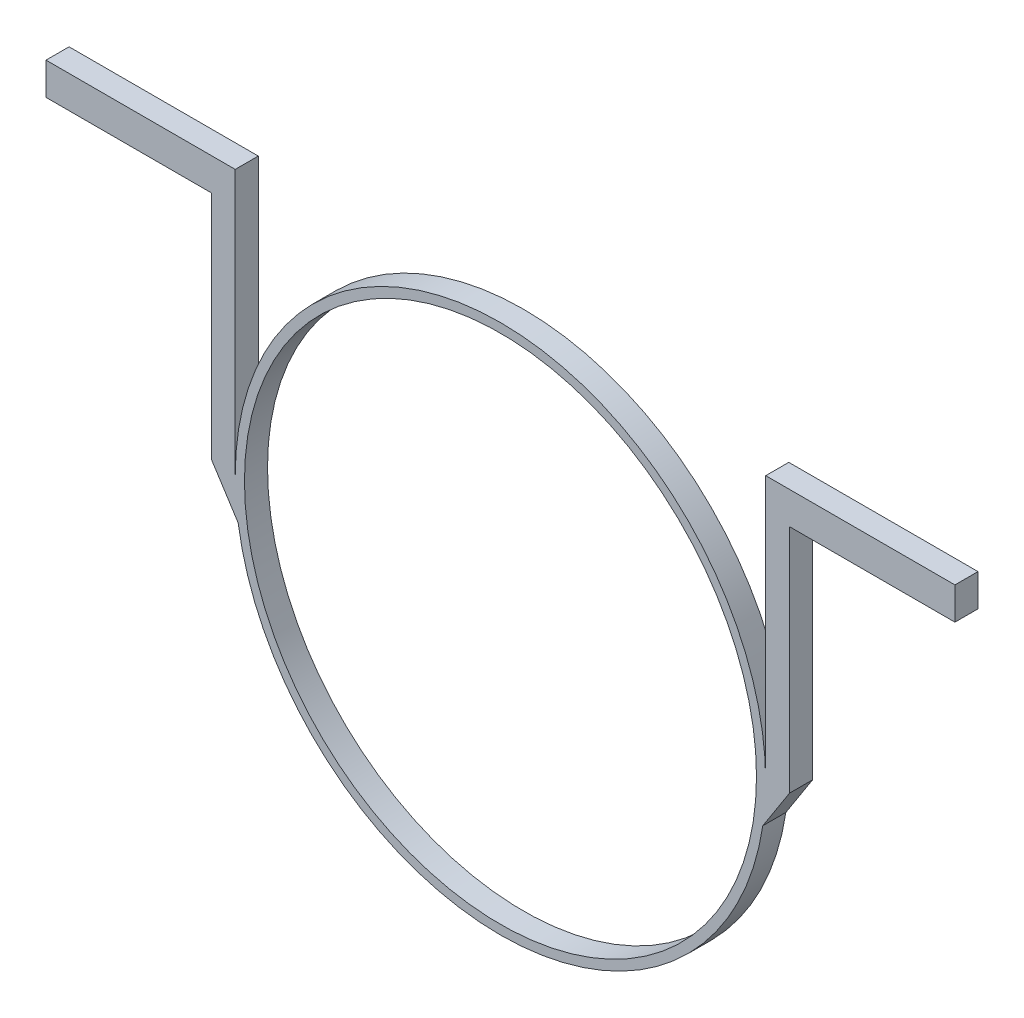
from build123d import *

# Parameters (mm, degrees)
SKETCH1_R           = 57.5
SKETCH1_R_2         = 55.5
BOSS_EXTRUDE1_DEPTH = 5


with BuildPart() as part:
    # Sketch1 → Boss-Extrude1 (new body)
    # profile 1 of 3: a face of its own
    with BuildSketch(Plane.XY):
        with BuildLine():
            ThreePointArc((-56.86052693, -8.551635942), (-57.33990887, -4.287755914), (-57.5, 0))
            Line((-57.5, 0), (-57.5, 57.5))
            Line((-57.5, 57.5), (-98.518106022, 57.5))
            Line((-98.518106022, 57.5), (-98.518106022, 50.5))
            Line((-98.518106022, 50.5), (-62.662833113, 50.5))
            Line((-62.662833113, 50.5), (-62.662833113, 0.474482067))
            Line((-62.662833113, 0.474482067), (-56.86052693, -8.551635942))
        make_face()
    # profile 2 of 3: a face of its own
    with BuildSketch(Plane.XY):
        Circle(SKETCH1_R)
        Circle(SKETCH1_R_2, mode=Mode.SUBTRACT)
    # profile 3 of 3: a face of its own
    with BuildSketch(Plane.XY):
        with BuildLine():
            Line((57.5, 57.5), (57.5, 0))
            ThreePointArc((57.5, 0), (57.33990887, -4.287755914), (56.86052693, -8.551635942))
            Line((56.86052693, -8.551635942), (62.662833113, 0.474482067))
            Line((62.662833113, 0.474482067), (62.662833113, 50.5))
            Line((62.662833113, 50.5), (98.518106022, 50.5))
            Line((98.518106022, 50.5), (98.518106022, 57.5))
            Line((98.518106022, 57.5), (57.5, 57.5))
        make_face()
    extrude(amount=BOSS_EXTRUDE1_DEPTH)


solid = part.part
